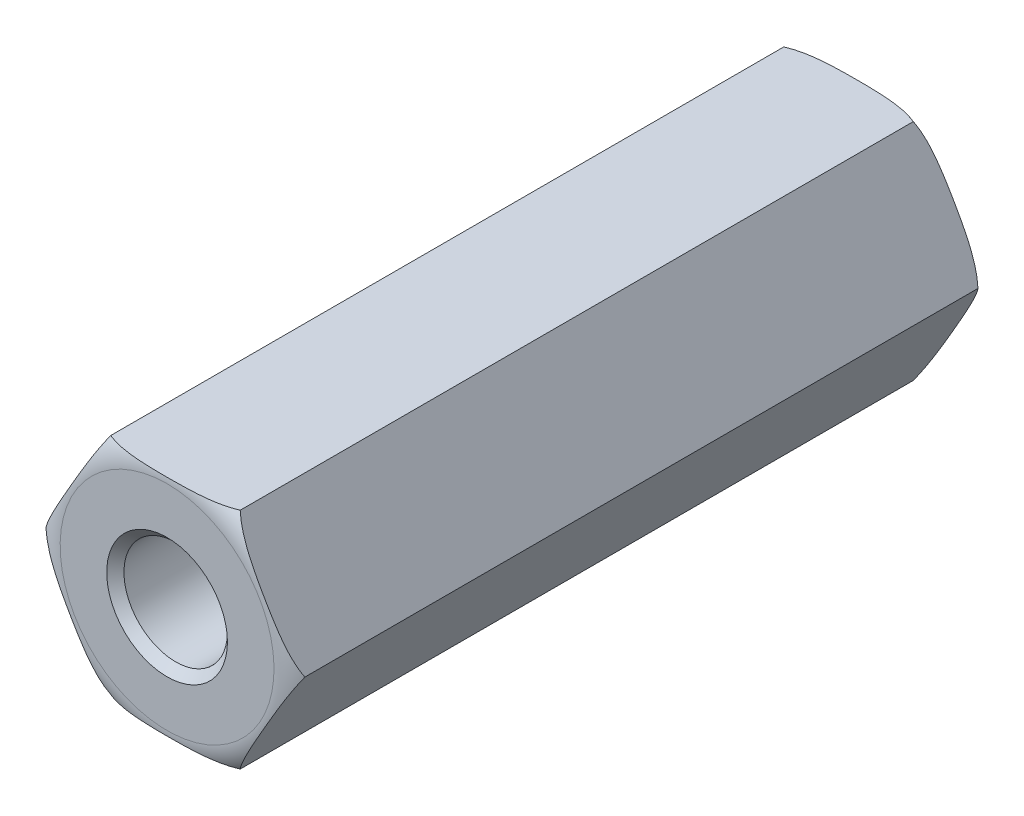
from build123d import *

# Parameters (mm, degrees)
BOSS_EXTRUDE2_DEPTH     = 20
CUT_EXTRUDE5_DEPTH      = 21.606936666
CUT_EXTRUDE5_DEPTH_BACK = 21.606936666
SKETCH2_R               = 1.5
CHAMFER1_SIZE           = 0.25


with BuildPart() as part:
    # Sketch3 → Boss-Extrude2 (new body)
    with BuildSketch(Plane.XY):
        Polygon((3.75277675, 0), (1.876388375, 3.25), (-1.876388375, 3.25), (-3.75277675, 0), (-1.876388375, -3.25), (1.876388375, -3.25), align=None)
    extrude(amount=BOSS_EXTRUDE2_DEPTH)

    # Sketch5 → Cut-Revolve1 (revolve, cut)
    with BuildSketch(Plane(origin=(0, 0, 0), x_dir=(0, 0, -1), z_dir=(1, 0, 0))):
        with BuildLine():
            Line((-20, 0), (-20, 3.1))
            ThreePointArc((-20, 3.1), (-19.707106781, 3.807106781), (-19, 4.1))
            Line((-19, 4.1), (-1, 4.1))
            ThreePointArc((-1, 4.1), (-0.292893219, 3.807106781), (0, 3.1))
            Line((0, 3.1), (0, 1.684209227))
            Line((0, 1.684209227), (1.086869428, 1.684209227))
            Line((1.086869428, 1.684209227), (1.086869428, 4.997067517))
            Line((1.086869428, 4.997067517), (-20.5, 4.997067517))
            Line((-20.5, 4.997067517), (-20.5, 0))
            Line((-20.5, 0), (-20, 0))
        make_face()
    revolve(axis=Axis((0, 0, 20), (0, 0, 1)), mode=Mode.SUBTRACT)

    # Sketch2 → Cut-Extrude5 (cut, two sides: drawn at the far end of the back side and taken through both)
    with BuildSketch(Plane.XY.offset(-CUT_EXTRUDE5_DEPTH_BACK)):
        Circle(SKETCH2_R)
    extrude(amount=CUT_EXTRUDE5_DEPTH + CUT_EXTRUDE5_DEPTH_BACK, mode=Mode.SUBTRACT)

    # Chamfer1
    chamfer1_edges = [part.edges().sort_by_distance(p)[0] for p in [
        (-1.5, 0, 0),
        (-1.5, 0, 20),
    ]]
    chamfer(chamfer1_edges, length=CHAMFER1_SIZE)


solid = part.part
